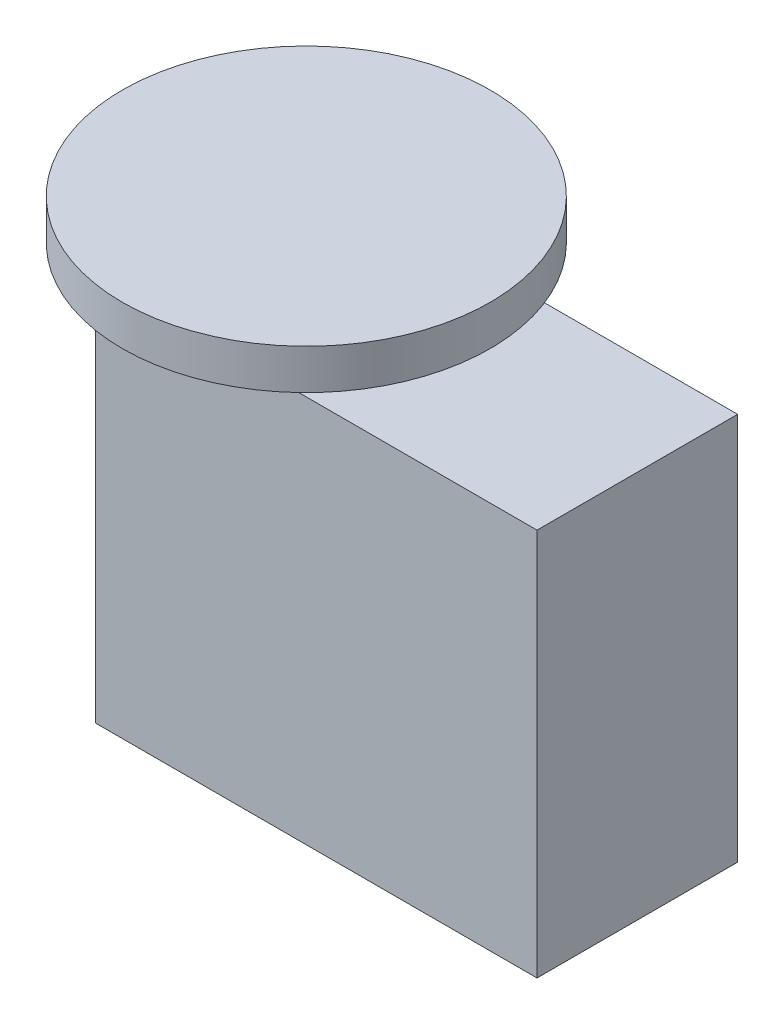
from build123d import *

# Parameters (mm, degrees)
SKETCH2_W                = 66
SKETCH2_H                = 30
BOSS_EXTRUDE1_DEPTH      = 58
SKETCH3_R                = 9
SKETCH3_R_2              = 7.5
BOSS_EXTRUDE2_DEPTH      = 2
SKETCH4_R                = 2.5
BOSS_EXTRUDE3_DEPTH      = 10
BOSS_EXTRUDE4_DEPTH      = 1
BOSS_EXTRUDE4_DEPTH_BACK = 5
SKETCH5_R                = 27.5
SKETCH6_W                = 6
SKETCH6_H                = 20
BOSS_EXTRUDE5_DEPTH      = 3
SKETCH7_R                = 1
BOSS_EXTRUDE6_DEPTH      = 3


with BuildPart() as part:
    # Sketch2 → Boss-Extrude1 (new body)
    with BuildSketch(Plane(origin=(0, 0, 0), x_dir=(1, 0, 0), z_dir=(0, 1, 0))):
        with Locations((-46.568123526, -34.860945828)):
            Rectangle(SKETCH2_W, SKETCH2_H)
    extrude(amount=BOSS_EXTRUDE1_DEPTH)

    # Sketch3 → Boss-Extrude2 (add)
    with BuildSketch(Plane(origin=(0, 58, 0), x_dir=(1, 0, 0), z_dir=(0, 1, 0))):
        with Locations(Location((-63.068123526, -34.860945828, 0), (0, 0, 270))):
            Circle(SKETCH3_R)
        with Locations(Location((-63.068123526, -34.860945828, 0), (0, 0, 270))):
            Circle(SKETCH3_R_2, mode=Mode.SUBTRACT)
    extrude(amount=BOSS_EXTRUDE2_DEPTH)

    # Sketch4 → Boss-Extrude3 (add)
    with BuildSketch(Plane(origin=(0, 58, 0), x_dir=(1, 0, 0), z_dir=(0, 1, 0))):
        with Locations(Location((-63.068123526, -34.860945828, 0), (0, 0, 270))):
            Circle(SKETCH4_R)
    extrude(amount=BOSS_EXTRUDE3_DEPTH)

    # Sketch5 → Boss-Extrude4 (add, two sides: drawn at the far end of the back side and taken through both)
    with BuildSketch(Plane(origin=(0, 68, 0), x_dir=(1, 0, 0), z_dir=(0, 1, 0)).offset(-BOSS_EXTRUDE4_DEPTH_BACK)):
        with Locations(Location((-63.068123526, -34.860945828, 0), (0, 0, 270))):
            Circle(SKETCH5_R)
    extrude(amount=BOSS_EXTRUDE4_DEPTH + BOSS_EXTRUDE4_DEPTH_BACK)

    # Sketch6 → Boss-Extrude5 (add)
    with BuildSketch(Plane.XZ):
        with Locations((-66.568123526, 34.860945828)):
            Rectangle(SKETCH6_W, SKETCH6_H)
    extrude(amount=BOSS_EXTRUDE5_DEPTH)

    # Sketch7 → Boss-Extrude6 (add)
    with BuildSketch(Plane.XZ.offset(3)):
        with Locations(Location((-66.568123526, 29.860945828, 0), (0, 0, 90))):
            Circle(SKETCH7_R)
        with Locations(Location((-66.568123526, 39.860945828, 0), (0, 0, 90))):
            Circle(SKETCH7_R)
    extrude(amount=BOSS_EXTRUDE6_DEPTH)


solid = part.part
